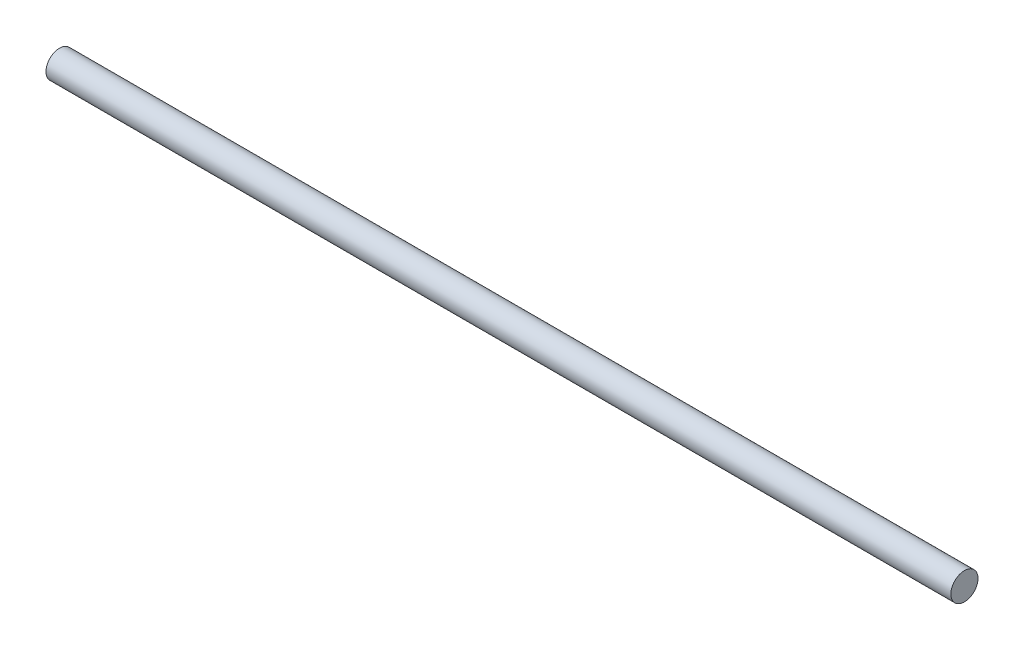
from build123d import *

# Parameters (mm, degrees)
CROQUIS1_R              = 7.5
SALIENTE_EXTRUIR1_DEPTH = 250


with BuildPart() as part:
    # Croquis1 → Saliente-Extruir1 (new, symmetric)
    with BuildSketch(Plane(origin=(0, 0, 0), x_dir=(0, 0, -1), z_dir=(1, 0, 0))):
        Circle(CROQUIS1_R)
    extrude(amount=SALIENTE_EXTRUIR1_DEPTH, both=True)


solid = part.part
